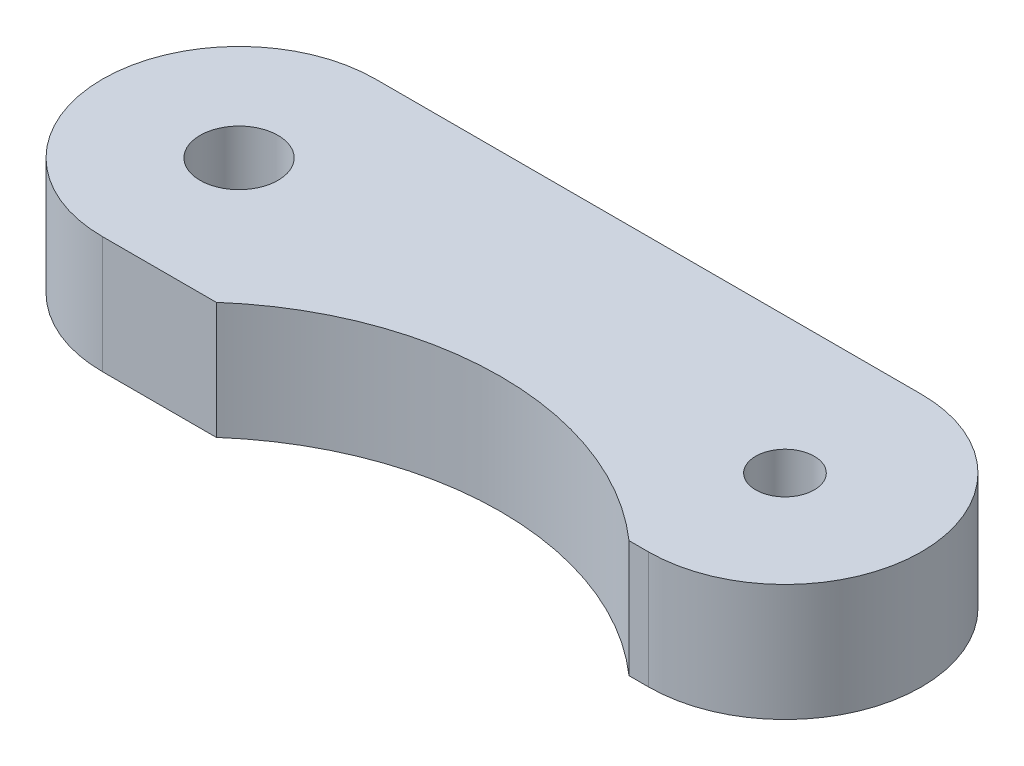
from build123d import *

# Parameters (mm, degrees)
SKETCH1_R           = 0.75
SKETCH1_R_2         = 1
BOSS_EXTRUDE1_DEPTH = 3
CUT_EXTRUDE1_DEPTH  = 10


with BuildPart() as part:
    # Sketch1 → Boss-Extrude1 (new body)
    with BuildSketch(Plane(origin=(0, 0, 0), x_dir=(1, 0, 0), z_dir=(0, 1, 0))):
        with BuildLine():
            Line((0, 3.5), (14, 3.5))
            ThreePointArc((14, 3.5), (17.5, 0), (14, -3.5))
            Line((14, -3.5), (0, -3.5))
            ThreePointArc((0, -3.5), (-3.5, 0), (0, 3.5))
        make_face()
        with Locations(Location((14, 0, 0), (0, 0, 270))):
            Circle(SKETCH1_R, mode=Mode.SUBTRACT)
        with Locations(Location((0, 0, 0), (0, 0, 270))):
            Circle(SKETCH1_R_2, mode=Mode.SUBTRACT)
    extrude(amount=BOSS_EXTRUDE1_DEPTH)

    # Sketch2 → Cut-Extrude1 (cut)
    with BuildSketch(Plane(origin=(0, 3, 0), x_dir=(1, 0, 0), z_dir=(0, 1, 0))):
        with BuildLine():
            Line((2.916994756, -3.5), (13.5, -3.5))
            ThreePointArc((13.5, -3.5), (8.208497378, -1.5), (2.916994756, -3.5))
        make_face()
    extrude(amount=-CUT_EXTRUDE1_DEPTH, mode=Mode.SUBTRACT)


solid = part.part
